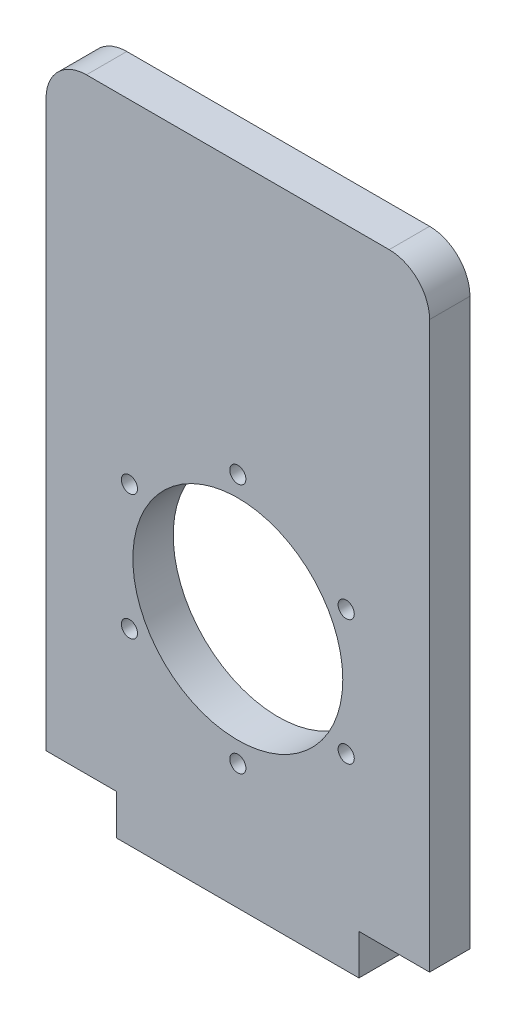
from build123d import *

# Parameters (mm, degrees)
SKETCH1_W           = 95
SKETCH1_H           = 150
SKETCH1_R           = 2
SKETCH1_R_2         = 26
SKETCH1_W_2         = 60
SKETCH1_H_2         = 10
BOSS_EXTRUDE1_DEPTH = 10
FILLET1_R           = 10


with BuildPart() as part:
    # Sketch1 → Boss-Extrude1 (new body)
    # profile 1 of 2: a face of its own
    with BuildSketch(Plane.XY):
        with Locations((0, 23)):
            Rectangle(SKETCH1_W, SKETCH1_H)
        with Locations((-26.846787517, 15.5)):
            Circle(SKETCH1_R, mode=Mode.SUBTRACT)
        with Locations((-26.846787517, -15.5)):
            Circle(SKETCH1_R, mode=Mode.SUBTRACT)
        with Locations((0, -31)):
            Circle(SKETCH1_R, mode=Mode.SUBTRACT)
        with Locations((26.846787517, -15.5)):
            Circle(SKETCH1_R, mode=Mode.SUBTRACT)
        with Locations((26.846787517, 15.5)):
            Circle(SKETCH1_R, mode=Mode.SUBTRACT)
        with Locations((0, 31)):
            Circle(SKETCH1_R, mode=Mode.SUBTRACT)
        Circle(SKETCH1_R_2, mode=Mode.SUBTRACT)
    # profile 2 of 2: a face of its own
    with BuildSketch(Plane.XY):
        with Locations((0, -57)):
            Rectangle(SKETCH1_W_2, SKETCH1_H_2)
    extrude(amount=BOSS_EXTRUDE1_DEPTH)

    # Fillet1
    fillet1_edges = [part.edges().sort_by_distance(p)[0] for p in [
        (-47.5, 98, 5),
        (47.5, 98, 5),
    ]]
    fillet(fillet1_edges, radius=FILLET1_R)


solid = part.part
